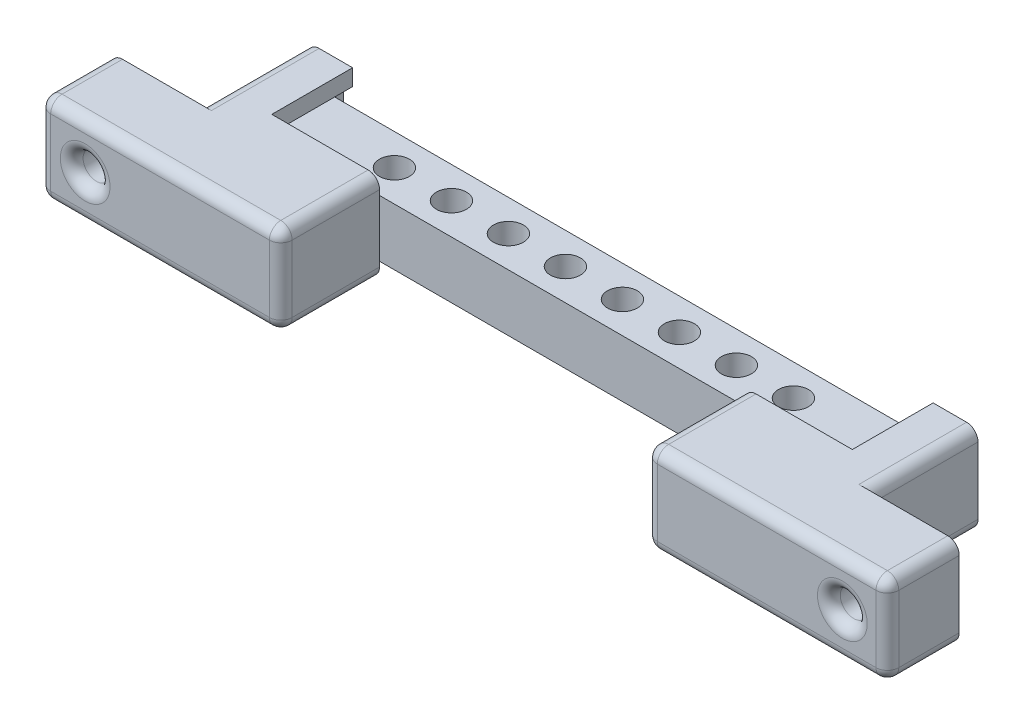
from build123d import *

# Parameters (mm, degrees)
BOSS_EXTRUDE1_DEPTH = 5
SKETCH2_W           = 40.676
SKETCH2_H           = 10
CUT_EXTRUDE1_DEPTH  = 49.76469559
SKETCH3_R           = 1.5
CUT_EXTRUDE2_DEPTH  = 49.999954449
SKETCH3_3_R         = 3.5
SKETCH3_3_R_2       = 1.5
CUT_EXTRUDE3_DEPTH  = 3
SKETCH5_W           = 66.676
SKETCH5_H           = 6.35
CUT_EXTRUDE4_DEPTH  = 9
SKETCH6_W           = 66.676
SKETCH6_H           = 6.35
BOSS_EXTRUDE2_DEPTH = 7
SKETCH7_R           = 1.670743861
CUT_EXTRUDE5_DEPTH  = 52.950227728
FILLET1_R           = 1.27
FILLET2_R           = 1.27


with BuildPart() as part:
    # Sketch1 → Boss-Extrude1 (new, symmetric)
    with BuildSketch(Plane(origin=(0, 0, 0), x_dir=(1, 0, 0), z_dir=(0, 1, 0))):
        Polygon((47.244, 0), (-47.244, 0), (-47.244, 8), (-37.338, 8), (-37.338, 20), (-32.338, 20), (-32.338, 11), (32.338, 11), (32.338, 20), (37.338, 20), (37.338, 8), (47.244, 8), align=None)
    extrude(amount=BOSS_EXTRUDE1_DEPTH, both=True)

    # Sketch2 → Cut-Extrude1 (cut, through all)
    with BuildSketch(Plane(origin=(0, 0, -11), x_dir=(-1, 0, 0), z_dir=(0, 0, -1))):
        Rectangle(SKETCH2_W, SKETCH2_H)
    extrude(amount=-CUT_EXTRUDE1_DEPTH, mode=Mode.SUBTRACT)


with BuildPart() as cut_extrude1_piece_1:
    # of the separate pieces the step leaves, piece 1, a body of its own (cut_extrude1_pieces)
    add(part.part.solids().sort_by_distance((47.244, -5, 0))[0])


with BuildPart() as cut_extrude1_piece_2:
    # of the separate pieces the step leaves, piece 2, a body of its own (cut_extrude1_pieces)
    add(part.part.solids().sort_by_distance((-20.338, 5, 0))[0])


with BuildPart() as cut_extrude2_tool:
    # Sketch3 → Cut-Extrude2 (new, through all)
    with BuildSketch(Plane(origin=(0, 0, -8), x_dir=(-1, 0, 0), z_dir=(0, 0, -1))):
        with Locations((42.132240282, 0)):
            Circle(SKETCH3_R)
        with Locations((-42.227346919, 0)):
            Circle(SKETCH3_R)
    extrude(amount=-CUT_EXTRUDE2_DEPTH)


with BuildPart() as cut_extrude1_piece_1_1:
    add(cut_extrude1_piece_1.part)

    # Cut-Extrude2: cut by cut_extrude2_tool
    add(cut_extrude2_tool.part, mode=Mode.SUBTRACT)


with BuildPart() as cut_extrude1_piece_2_1:
    add(cut_extrude1_piece_2.part)

    # Cut-Extrude2: cut by cut_extrude2_tool
    add(cut_extrude2_tool.part, mode=Mode.SUBTRACT)


with BuildPart() as cut_extrude3_tool:
    # Sketch3<3> → Cut-Extrude3 (new body)
    # profile 1 of 2: a face of its own
    with BuildSketch(Plane(origin=(0, 0, -8), x_dir=(-1, 0, 0), z_dir=(0, 0, -1))):
        with Locations((-42.227346919, 0)):
            Circle(SKETCH3_3_R)
        with Locations((-42.227346919, 0)):
            Circle(SKETCH3_3_R_2, mode=Mode.SUBTRACT)
    # profile 2 of 2: a face of its own
    with BuildSketch(Plane(origin=(0, 0, -8), x_dir=(-1, 0, 0), z_dir=(0, 0, -1))):
        with Locations((42.132240282, 0)):
            Circle(SKETCH3_3_R)
    extrude(amount=-CUT_EXTRUDE3_DEPTH)


with BuildPart() as cut_extrude1_piece_1_2:
    add(cut_extrude1_piece_1_1.part)

    # Cut-Extrude3: cut by cut_extrude3_tool
    add(cut_extrude3_tool.part, mode=Mode.SUBTRACT)


with BuildPart() as cut_extrude1_piece_2_2:
    add(cut_extrude1_piece_2_1.part)

    # Cut-Extrude3: cut by cut_extrude3_tool
    add(cut_extrude3_tool.part, mode=Mode.SUBTRACT)


with BuildPart() as cut_extrude4_tool:
    # Sketch5 → Cut-Extrude4 (new body)
    with BuildSketch(Plane(origin=(0, 0, -20), x_dir=(-1, 0, 0), z_dir=(0, 0, -1))):
        Rectangle(SKETCH5_W, SKETCH5_H)
    extrude(amount=-CUT_EXTRUDE4_DEPTH)


with BuildPart() as cut_extrude1_piece_1_3:
    add(cut_extrude1_piece_1_2.part)

    # Cut-Extrude4: cut by cut_extrude4_tool
    add(cut_extrude4_tool.part, mode=Mode.SUBTRACT)

    # Fillet1
    fillet1_edges = [cut_extrude1_piece_1_3.edges().sort_by_distance(p)[0] for p in [
        (20.338, 0, 0),
        (33.791, -5, 0),
        (33.791, 5, 0),
        (47.244, 5, -4),
        (43.727346919, 0, 0),
        (37.338, 5, -14),
        (20.338, -5, -5.5),
        (47.244, -5, -4),
        (47.244, 0, 0),
        (37.338, -5, -14),
        (20.338, 5, -5.5),
    ]]
    fillet(fillet1_edges, radius=FILLET1_R)


with BuildPart() as cut_extrude1_piece_2_3:
    add(cut_extrude1_piece_2_2.part)

    # Cut-Extrude4: cut by cut_extrude4_tool
    add(cut_extrude4_tool.part, mode=Mode.SUBTRACT)

    # Fillet2
    fillet2_edges = [cut_extrude1_piece_2_3.edges().sort_by_distance(p)[0] for p in [
        (-37.338, -5, -14),
        (-33.791, -5, 0),
        (-47.244, -5, -4),
        (-47.244, 0, 0),
        (-20.338, 0, 0),
        (-20.338, 5, -5.5),
        (-37.338, 5, -14),
        (-20.338, -5, -5.5),
        (-47.244, 5, -4),
        (-40.632240282, 0, 0),
        (-33.791, 5, 0),
    ]]
    fillet(fillet2_edges, radius=FILLET2_R)


with BuildPart() as body_3:
    # Sketch6 → Boss-Extrude2 (new body)
    with BuildSketch(Plane(origin=(0, 0, -11), x_dir=(-1, 0, 0), z_dir=(0, 0, -1))):
        Rectangle(SKETCH6_W, SKETCH6_H)
    extrude(amount=BOSS_EXTRUDE2_DEPTH)

    # Sketch7 → Cut-Extrude5 (cut, through all)
    with BuildSketch(Plane.XZ.offset(3.175)):
        with Locations(Location((-22.178, -14.5, 0), (0, 0, 270))):
            Circle(SKETCH7_R)
        with Locations(Location((-15.828, -14.5, 0), (0, 0, 270))):
            Circle(SKETCH7_R)
        with Locations(Location((-9.478, -14.5, 0), (0, 0, 270))):
            Circle(SKETCH7_R)
        with Locations(Location((-3.128, -14.5, 0), (0, 0, 270))):
            Circle(SKETCH7_R)
        with Locations(Location((3.222, -14.5, 0), (0, 0, 270))):
            Circle(SKETCH7_R)
        with Locations(Location((9.572, -14.5, 0), (0, 0, 270))):
            Circle(SKETCH7_R)
        with Locations(Location((15.922, -14.5, 0), (0, 0, 270))):
            Circle(SKETCH7_R)
        with Locations(Location((22.272, -14.5, 0), (0, 0, 270))):
            Circle(SKETCH7_R)
    extrude(amount=-CUT_EXTRUDE5_DEPTH, mode=Mode.SUBTRACT)


solid = Compound([cut_extrude1_piece_1_3.part, cut_extrude1_piece_2_3.part, body_3.part])
